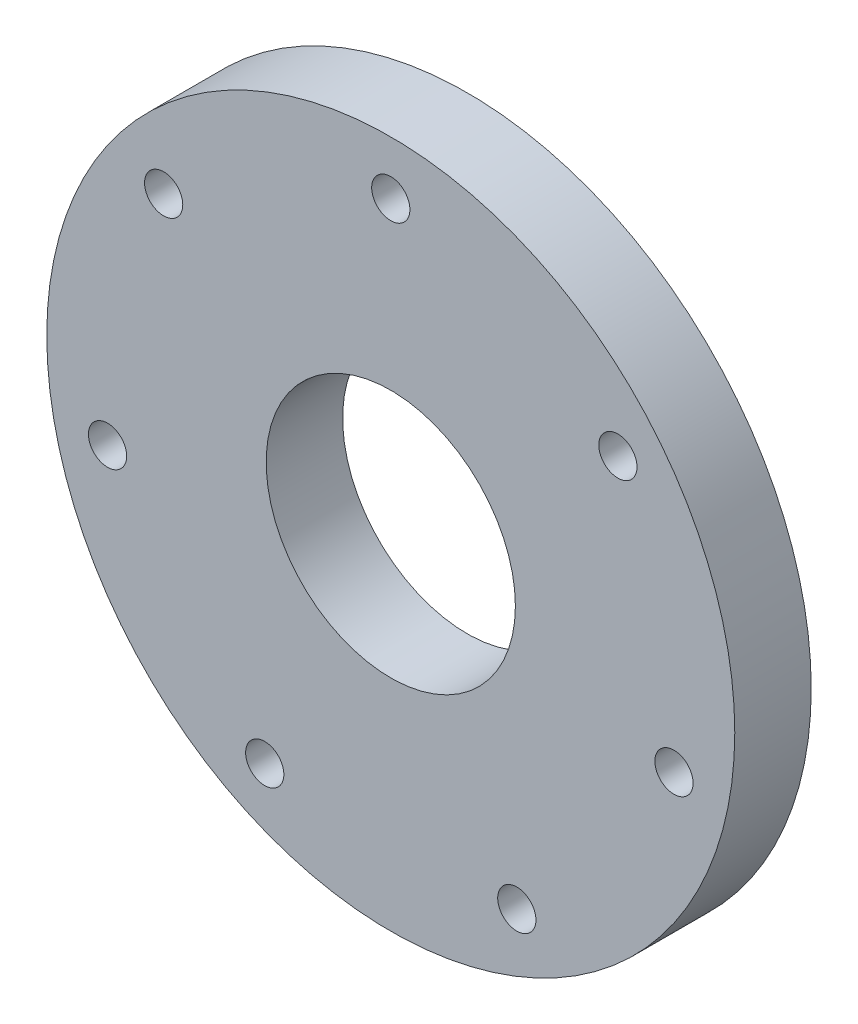
from build123d import *

# Parameters (mm, degrees)
SKETCH1_R           = 22.5
SKETCH1_R_2         = 1.25
SKETCH1_R_3         = 8.15
BOSS_EXTRUDE1_DEPTH = 5


with BuildPart() as part:
    # Sketch1 → Boss-Extrude1 (new body)
    with BuildSketch(Plane.XY):
        Circle(SKETCH1_R)
        with Locations((0, 19)):
            Circle(SKETCH1_R_2, mode=Mode.SUBTRACT)
        with Locations((14.854798167, 11.846306235)):
            Circle(SKETCH1_R_2, mode=Mode.SUBTRACT)
        with Locations((18.523630331, -4.227897745)):
            Circle(SKETCH1_R_2, mode=Mode.SUBTRACT)
        with Locations((8.243791043, -17.11840849)):
            Circle(SKETCH1_R_2, mode=Mode.SUBTRACT)
        with Locations((-8.243791043, -17.11840849)):
            Circle(SKETCH1_R_2, mode=Mode.SUBTRACT)
        with Locations((-18.523630331, -4.227897745)):
            Circle(SKETCH1_R_2, mode=Mode.SUBTRACT)
        Circle(SKETCH1_R_3, mode=Mode.SUBTRACT)
        with Locations((-14.854798167, 11.846306235)):
            Circle(SKETCH1_R_2, mode=Mode.SUBTRACT)
    extrude(amount=BOSS_EXTRUDE1_DEPTH)


solid = part.part
